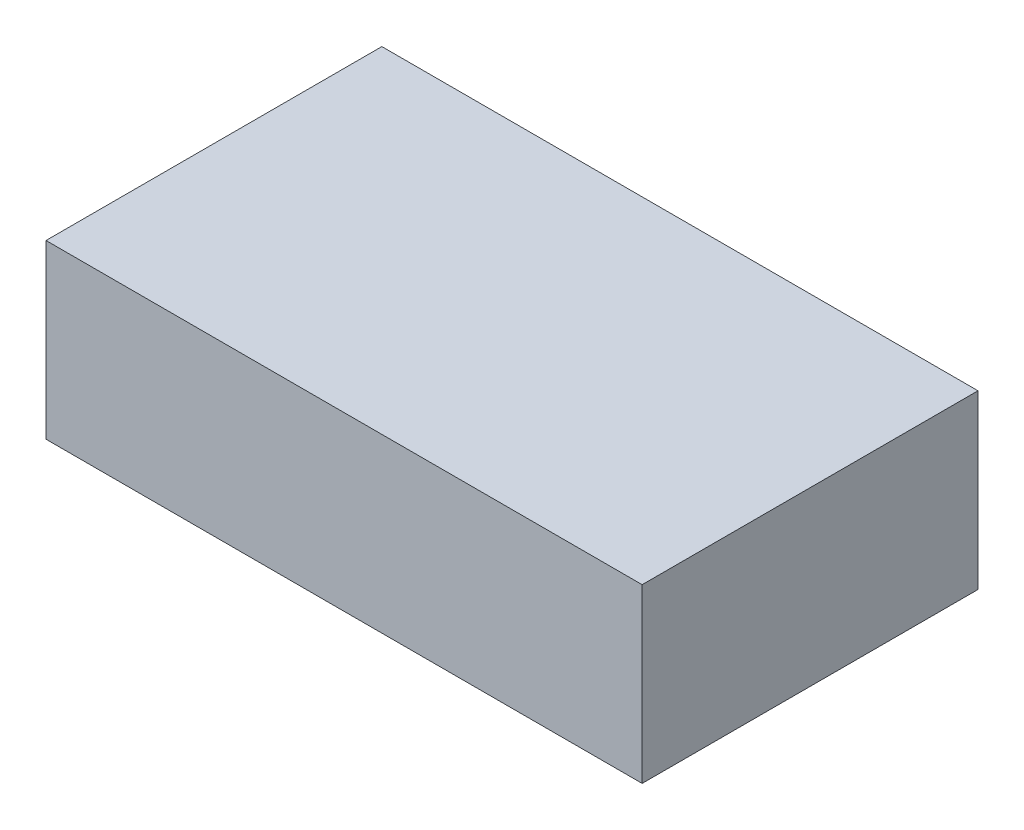
from build123d import *

# Parameters (mm, degrees)
SKETCH1_W           = 142
SKETCH1_H           = 80
BOSS_EXTRUDE1_DEPTH = 41


with BuildPart() as part:
    # Sketch1 → Boss-Extrude1 (new body)
    with BuildSketch(Plane(origin=(0, 0, 0), x_dir=(1, 0, 0), z_dir=(0, 1, 0))):
        Rectangle(SKETCH1_W, SKETCH1_H)
    extrude(amount=BOSS_EXTRUDE1_DEPTH)


solid = part.part
